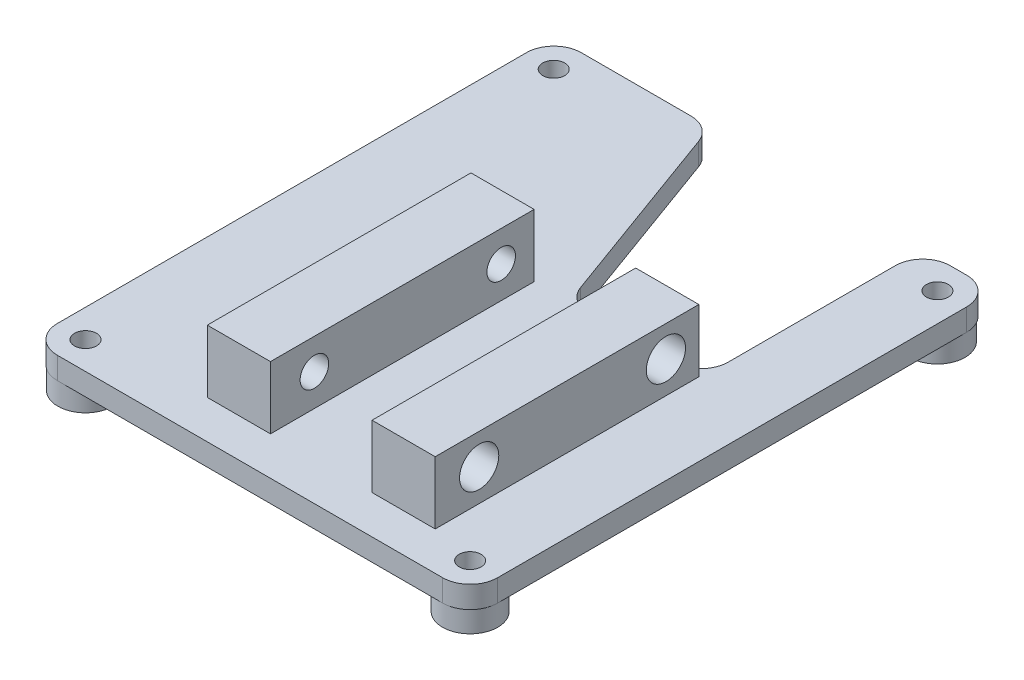
from build123d import *

# Parameters (mm, degrees)
SKETCH1_W                                = 20.746
SKETCH1_H                                = 24
BOSS_EXTRUDE1_DEPTH                      = 5.7
SKETCH9_W                                = 9.246
SKETCH9_H                                = 24
CUT_EXTRUDE3_DEPTH                       = 17.854943755
F_9_64_0_14063_DIAMETER_HOLE1_AT_2_COUNT = 2
F_9_64_0_14063_DIAMETER_HOLE1_AT_2_PITCH = 17
SKETCH8_R                                = 1.3
CUT_EXTRUDE2_DEPTH                       = 5.75
SKETCH10_W                               = 40.08
SKETCH10_H                               = 47.7
BOSS_EXTRUDE2_DEPTH                      = 2
SKETCH11_R                               = 2.515
BOSS_EXTRUDE3_DEPTH                      = 2
SKETCH12_R                               = 1
CUT_EXTRUDE4_DEPTH                       = 41.757486785
FILLET2_R                                = 2.5
CUT_EXTRUDE5_DEPTH                       = 40.994658756
FILLET3_R                                = 2.5
CUT_EXTRUDE6_DEPTH                       = 5.7


with BuildPart() as part:
    # Sketch1 → Boss-Extrude1 (new body)
    with BuildSketch(Plane(origin=(0, 0, 0), x_dir=(1, 0, 0), z_dir=(0, 1, 0))):
        Rectangle(SKETCH1_W, SKETCH1_H)
    extrude(amount=BOSS_EXTRUDE1_DEPTH)

    # Sketch9 → Cut-Extrude3 (cut, through all)
    with BuildSketch(Plane.XZ):
        Rectangle(SKETCH9_W, SKETCH9_H)
    extrude(amount=-CUT_EXTRUDE3_DEPTH, mode=Mode.SUBTRACT)


with BuildPart() as cut_extrude3_piece_1:
    # of the separate pieces the step leaves, piece 1, a body of its own (cut_extrude3_pieces)
    add(part.part.solids().sort_by_distance((-10.373, 0, -12))[0])

    # Sketch8 → Cut-Extrude2 (cut)
    with BuildSketch(Plane.ZY.offset(10.373)):
        with Locations((8, 2.9)):
            Circle(SKETCH8_R)
        with Locations((-9, 2.9)):
            Circle(SKETCH8_R)
    extrude(amount=-CUT_EXTRUDE2_DEPTH, mode=Mode.SUBTRACT)



with BuildPart() as cut_extrude3_piece_2:
    # of the separate pieces the step leaves, piece 2, a body of its own (cut_extrude3_pieces)
    add(part.part.solids().sort_by_distance((4.623, 0, -12))[0])

    # Sketch7 → 9/64 (0.14063) Diameter Hole1 (revolve, cut)
    with BuildSketch(Plane(origin=(10.373, 2.9, -9), x_dir=(0, 0, -1), z_dir=(0, 1, 0))):
        Polygon((0, 0), (0, 6.823137666), (1.786001, 5.75), (1.786001, 0), align=None)
    f_9_64_0_14063_diameter_hole1 = revolve(axis=Axis((16.723, 2.9, -9), (-1, 0, 0)), mode=Mode.SUBTRACT)

    # 9/64 (0.14063) Diameter Hole1 at 2: 9/64 (0.14063) Diameter Hole1 ×2
    with Locations(*[(0, 0, i * F_9_64_0_14063_DIAMETER_HOLE1_AT_2_PITCH) for i in range(1, F_9_64_0_14063_DIAMETER_HOLE1_AT_2_COUNT)]):
        add(f_9_64_0_14063_diameter_hole1, mode=Mode.SUBTRACT)


with BuildPart() as cut_extrude3_piece_1_1:
    add(cut_extrude3_piece_1.part)

    add(cut_extrude3_piece_2.part)  # Boss-Extrude2 merges Cut-Extrude3 piece 2
    # Sketch10 → Boss-Extrude2 (add)
    with BuildSketch(Plane.XZ):
        with Locations((-2.987, -8.35)):
            Rectangle(SKETCH10_W, SKETCH10_H)
    extrude(amount=BOSS_EXTRUDE2_DEPTH)

    # Sketch11 → Boss-Extrude3 (add)
    with BuildSketch(Plane.XZ.offset(2)):
        with Locations(Location((14.453, 12.9, 0), (0, 0, 90))):
            Circle(SKETCH11_R)
        with Locations(Location((-20.475, 12.985, 0), (0, 0, 90))):
            Circle(SKETCH11_R)
        with Locations(Location((14.45, -29.6362, 0), (0, 0, 90))):
            Circle(SKETCH11_R)
        with Locations(Location((-20.475, -29.6362, 0), (0, 0, 90))):
            Circle(SKETCH11_R)
    extrude(amount=BOSS_EXTRUDE3_DEPTH)

    # Sketch12 → Cut-Extrude4 (cut, through all)
    with BuildSketch(Plane.XZ.offset(4)):
        with Locations(Location((14.453, 12.9, 0), (0, 0, 270))):
            Circle(SKETCH12_R)
        with Locations(Location((-20.475, 12.985, 0), (0, 0, 270))):
            Circle(SKETCH12_R)
        with Locations(Location((-20.475, -29.6362, 0), (0, 0, 270))):
            Circle(SKETCH12_R)
        with Locations(Location((14.45, -29.6362, 0), (0, 0, 270))):
            Circle(SKETCH12_R)
    extrude(amount=-CUT_EXTRUDE4_DEPTH, mode=Mode.SUBTRACT)

    # Fillet2
    fillet2_edges = [cut_extrude3_piece_1_1.edges().sort_by_distance(p)[0] for p in [
        (17.053, -1, -32.2),
        (17.053, -1, 15.5),
        (-23.027, -1, 15.5),
        (-23.027, -1, -32.2),
    ]]
    fillet(fillet2_edges, radius=FILLET2_R)

    # Sketch14 → Cut-Extrude5 (cut, through all)
    with BuildSketch(Plane(origin=(0, 0, 0), x_dir=(1, 0, 0), z_dir=(0, 1, 0))):
        Polygon((10.553, 32.2), (10.553, 12), (-1.447, 12), (-8.799198732, 32.2), align=None)
    extrude(amount=-CUT_EXTRUDE5_DEPTH, mode=Mode.SUBTRACT)

    # Fillet3
    fillet3_edges = [cut_extrude3_piece_1_1.edges().sort_by_distance(p)[0] for p in [
        (10.553, -1, -12),
        (-1.447, -1, -12),
        (10.553, -1, -32.2),
        (-8.799198732, -1, -32.2),
    ]]
    fillet(fillet3_edges, radius=FILLET3_R)

    # Sketch15 → Cut-Extrude6 (cut)
    with BuildSketch(Plane(origin=(0, 5.7, 0), x_dir=(1, 0, 0), z_dir=(0, 1, 0))):
        with BuildLine():
            Line((8.053, 12), (10.373, 12))
            Line((10.373, 12), (10.373, 13.568549518))
            ThreePointArc((10.373, 13.568549518), (9.453245299, 12.428934308), (8.053, 12))
        make_face()
    extrude(amount=-CUT_EXTRUDE6_DEPTH, mode=Mode.SUBTRACT)


solid = cut_extrude3_piece_1_1.part
